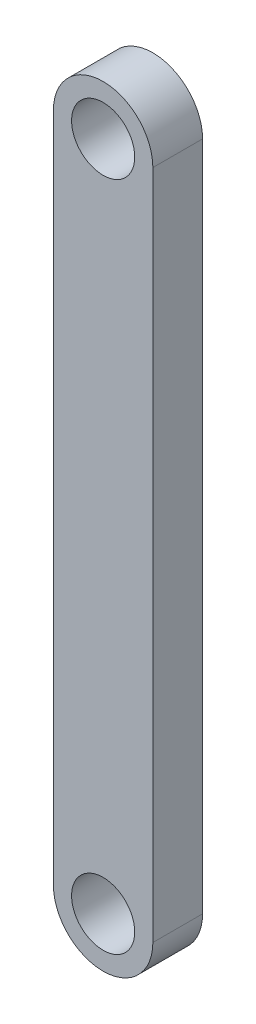
from build123d import *

# Parameters (mm, degrees)
BOSS_EXTRUDE1_DEPTH = 10
SKETCH2_R           = 6.35
CUT_EXTRUDE1_DEPTH  = 146.688022843


with BuildPart() as part:
    # Sketch1 → Boss-Extrude1 (new body)
    with BuildSketch(Plane.XY):
        with BuildLine():
            Line((-10, 0), (-10, 135))
            ThreePointArc((-10, 135), (0, 145), (10, 135))
            Line((10, 135), (10, 0))
            ThreePointArc((10, 0), (0, -10), (-10, 0))
        make_face()
    extrude(amount=BOSS_EXTRUDE1_DEPTH)

    # Sketch2 → Cut-Extrude1 (cut, through all)
    with BuildSketch(Plane.XY.offset(10)):
        with Locations((0, 135)):
            Circle(SKETCH2_R)
        Circle(SKETCH2_R)
    extrude(amount=-CUT_EXTRUDE1_DEPTH, mode=Mode.SUBTRACT)


solid = part.part
